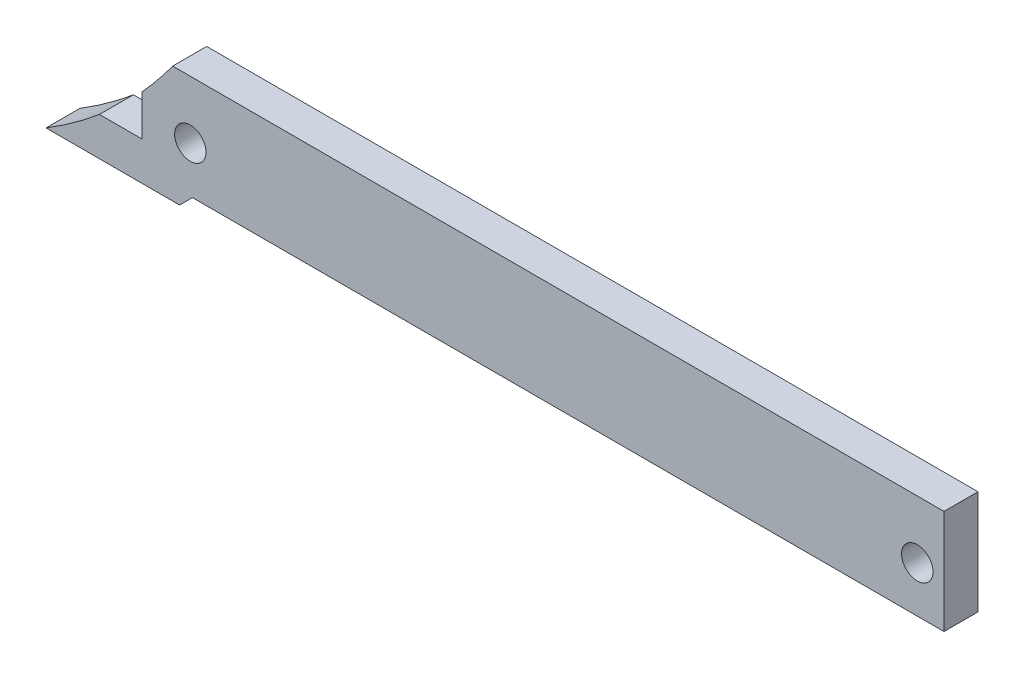
from build123d import *

# Parameters (mm, degrees)
SKETCH1_R           = 1.47
BOSS_EXTRUDE1_DEPTH = 3.18
SKETCH3_R           = 1.47
CUT_EXTRUDE1_DEPTH  = 76.165537316
CUT_EXTRUDE2_START  = -0.08
SKETCH4_W           = 75
SKETCH4_H           = 3.18
CUT_EXTRUDE2_DEPTH  = 0.08
BOSS_EXTRUDE2_DEPTH = 3.18


with BuildPart() as part:
    # Sketch1 → Boss-Extrude1 (new body)
    with BuildSketch(Plane.XY):
        with BuildLine():
            Line((0, 0), (0, 3.84))
            Line((0, 3.84), (75, 3.84))
            Line((75, 3.84), (75, 0.02441688))
            Line((75, 0.02441688), (75, -2.47558312))
            Line((75, -2.47558312), (4.70169557, -2.47558312))
            Line((4.70169557, -2.47558312), (3.5, -3.67727869))
            Line((3.5, -3.67727869), (-9, -3.67727869))
            ThreePointArc((-9, -3.67727869), (-6.432825468, -1.973348375), (-4, -0.082548586))
            Line((-4, -0.082548586), (0, -0.082548586))
            Line((0, -0.082548586), (0, 0))
        make_face()
        with Locations(Location((72.5, 1.84, 0), (0, 0, 180))):
            Circle(SKETCH1_R, mode=Mode.SUBTRACT)
    extrude(amount=BOSS_EXTRUDE1_DEPTH)

    # Sketch3 → Cut-Extrude1 (cut, through all)
    with BuildSketch(Plane.XY.offset(3.18)):
        with Locations((4.5, 1.84)):
            Circle(SKETCH3_R)
    extrude(amount=-CUT_EXTRUDE1_DEPTH, mode=Mode.SUBTRACT)

    # Sketch4 → Cut-Extrude2 (cut)
    with BuildSketch(Plane(origin=(0, 3.84, 0), x_dir=(1, 0, 0), z_dir=(0, 1, 0)).offset(CUT_EXTRUDE2_START)):
        with Locations((37.5, -1.59)):
            Rectangle(SKETCH4_W, SKETCH4_H)
    extrude(amount=CUT_EXTRUDE2_DEPTH, mode=Mode.SUBTRACT)

    # Sketch6 → Boss-Extrude2 (add)
    with BuildSketch(Plane(origin=(0, 0, 0), x_dir=(-1, 0, 0), z_dir=(0, 0, -1))):
        with BuildLine():
            Line((-2.850337408, 7.26), (-75, 7.26))
            Line((-75, 7.26), (-75, 3.76))
            Line((-75, 3.76), (0, 3.76))
            ThreePointArc((0, 3.76), (-1.47307826, 5.470983314), (-2.850337408, 7.26))
        make_face()
    extrude(amount=-BOSS_EXTRUDE2_DEPTH)


solid = part.part
